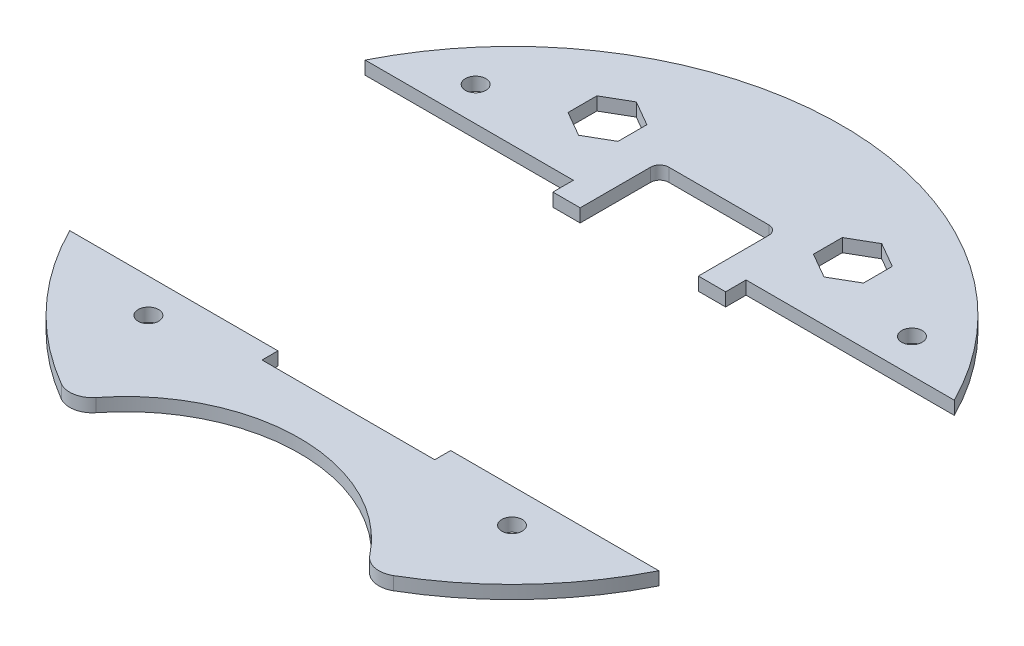
from build123d import *

# Parameters (mm, degrees)
BOSS_EXTRUDE1_DEPTH  = 2.9
SOLENOID_PLACEMENT_W = 38
SOLENOID_PLACEMENT_H = 64
CUT_EXTRUDE1_DEPTH   = 103.571487266
CUT_EXTRUDE5_DEPTH   = 103.571487266
SKETCH6_R            = 2.25
CUT_EXTRUDE6_DEPTH   = 103.571487266
CUT_EXTRUDE3_DEPTH   = 103.571487266
CUT_EXTRUDE7_DEPTH   = 98.286484159


with BuildPart() as part:
    # Sketch1 → Boss-Extrude1 (new body)
    with BuildSketch(Plane(origin=(0, 0, 0), x_dir=(1, 0, 0), z_dir=(0, 1, 0))):
        with BuildLine():
            ThreePointArc((36.543377003, -62.616544118), (0, 72.5), (-36.543377003, -62.616544118))
            ThreePointArc((-36.543377003, -62.616544118), (-33.085954668, -63.20954405), (-30.089832649, -61.38507948))
            ThreePointArc((-30.089832649, -61.38507948), (0, -46.75), (30.089832649, -61.38507948))
            ThreePointArc((30.089832649, -61.38507948), (33.085954668, -63.20954405), (36.543377003, -62.616544118))
        make_face()
    extrude(amount=BOSS_EXTRUDE1_DEPTH)

    # solenoid placement → Cut-Extrude1 (cut, through all)
    with BuildSketch(Plane(origin=(0, 2.9, 0), x_dir=(1, 0, 0), z_dir=(0, 1, 0))):
        with Locations((0, -4)):
            Rectangle(SOLENOID_PLACEMENT_W, SOLENOID_PLACEMENT_H)
    extrude(amount=-CUT_EXTRUDE1_DEPTH, mode=Mode.SUBTRACT)

    # Sketch5 → Cut-Extrude5 (cut, through all)
    with BuildSketch(Plane(origin=(0, 2.9, 0), x_dir=(1, 0, 0), z_dir=(0, 1, 0))):
        Polygon((-21.5, 51.175426481), (-27, 54.350852961), (-32.5, 51.175426481), (-32.5, 44.824573519), (-27, 41.649147039), (-21.5, 44.824573519), align=None)
        Polygon((21.5, 51.175426481), (21.5, 44.824573519), (27, 41.649147039), (32.5, 44.824573519), (32.5, 51.175426481), (27, 54.350852961), align=None)
    extrude(amount=-CUT_EXTRUDE5_DEPTH, mode=Mode.SUBTRACT)

    # Sketch6 → Cut-Extrude6 (cut, through all)
    with BuildSketch(Plane(origin=(0, 2.9, 0), x_dir=(1, 0, 0), z_dir=(0, 1, 0))):
        with Locations(Location((48, 40, 0), (0, 0, 270))):
            Circle(SKETCH6_R)
        with Locations(Location((-48, 40, 0), (0, 0, 270))):
            Circle(SKETCH6_R)
        with Locations(Location((40, -40, 0), (0, 0, 270))):
            Circle(SKETCH6_R)
        with Locations(Location((-40, -40, 0), (0, 0, 270))):
            Circle(SKETCH6_R)
    extrude(amount=-CUT_EXTRUDE6_DEPTH, mode=Mode.SUBTRACT)

    # Sketch3 → Cut-Extrude3 (cut, through all)
    with BuildSketch(Plane(origin=(0, 2.9, 0), x_dir=(1, 0, 0), z_dir=(0, 1, 0))):
        Polygon((-19, 28), (-19, 32.5), (-72.5, 32.5), (-72.5, -32.5), (72.5, -32.5), (72.5, 32.5), (19, 32.5), (19, 28), align=None)
    extrude(amount=-CUT_EXTRUDE3_DEPTH, mode=Mode.SUBTRACT)


with BuildPart() as cut_extrude3_piece_1:
    # of the separate pieces the step leaves, piece 1, a body of its own (cut_extrude3_pieces)
    add(part.part.solids().sort_by_distance((64.807406984, 0, -32.5))[0])

    # Sketch7 → Cut-Extrude7 (cut, through all)
    with BuildSketch(Plane(origin=(0, 2.9, 0), x_dir=(1, 0, 0), z_dir=(0, 1, 0))):
        with BuildLine():
            Line((13, 28), (13, 43.5))
            ThreePointArc((13, 43.5), (12.414213562, 44.914213562), (11, 45.5))
            Line((11, 45.5), (-11, 45.5))
            ThreePointArc((-11, 45.5), (-12.414213562, 44.914213562), (-13, 43.5))
            Line((-13, 43.5), (-13, 28))
            Line((-13, 28), (13, 28))
        make_face()
    extrude(amount=-CUT_EXTRUDE7_DEPTH, mode=Mode.SUBTRACT)


with BuildPart() as cut_extrude3_piece_2:
    # of the separate pieces the step leaves, piece 2, a body of its own (cut_extrude3_pieces)
    add(part.part.solids().sort_by_distance((-36.543377003, 0, 62.616544118))[0])


solid = Compound([cut_extrude3_piece_1.part, cut_extrude3_piece_2.part])
